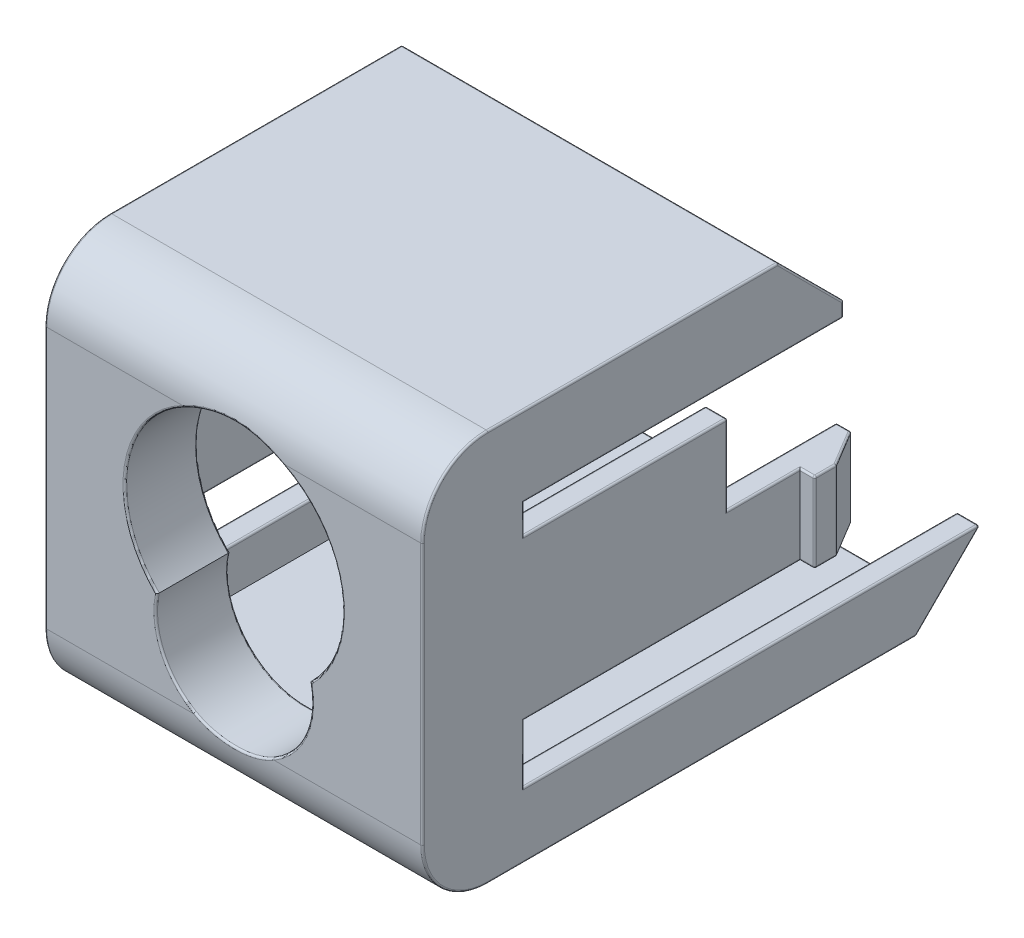
from build123d import *
from build123d.topology import SkipClean

# Parameters (mm, degrees)
EXTRUSION1_DEPTH      = 10.4
EXTRUSION1_DEPTH_BACK = 10.4
EXTRUSION2_DEPTH      = 9.2
EXTRUSION5_DEPTH      = 4
SKETCH4_W             = 1.2
SKETCH4_H             = 4
EXTRUSION6_DEPTH      = 4.4
EXTRUSION8_DEPTH      = 35.506810922
EXTRUSION9_DEPTH      = 2.4
FILLET1_R             = 0.1


with BuildPart() as part:
    # Sketch1 → Extrusion1 (new, two sides: drawn at the far end of the back side and taken through both)
    with BuildSketch(Plane.YZ.offset(-EXTRUSION1_DEPTH_BACK)):
        Polygon((-9.6, -10.8), (-10.8, -10.8), (-10.8, -21.6), (-9.6, -22.8), align=None)
        with BuildLine():
            Line((7.2, 5.6), (-7.2, 5.6))
            ThreePointArc((-7.2, 5.6), (-9.745584412, 4.545584412), (-10.8, 2))
            Line((-10.8, 2), (-10.8, -10.8))
            Line((-10.8, -10.8), (-9.6, -10.8))
            Line((-9.6, -10.8), (-9.6, 4))
            Line((-9.6, 4), (9.36, 4))
            Line((9.36, 4), (9.36, -15.44))
            Line((9.36, -15.44), (10.8, -14))
            Line((10.8, -14), (10.8, 2))
            ThreePointArc((10.8, 2), (9.745584412, 4.545584412), (7.2, 5.6))
        make_face()
        Polygon((6.4, 0), (6.4, -17.6), (7.2, -17.6), (9.36, -15.44), (9.36, 4), (-9.6, 4), (-9.6, -10.8), (-9.6, -22.8), (-7.2, -25.2), (-7.2, 0), (-4, 0), (-4, -15.2), (0.4, -15.2), (0.4, -11.2), (4.8, -11.2), (4.8, 0), align=None)
    extrude(amount=EXTRUSION1_DEPTH + EXTRUSION1_DEPTH_BACK)

    # Sketch2 → Extrusion2 (cut, symmetric)
    with BuildSketch(Plane.YZ):
        Polygon((7.2, -17.6), (9.36, -15.44), (9.36, 4), (-9.6, 4), (-9.6, -10.8), (-9.6, -22.8), (-7.2, -25.2), (-7.2, 0), (-4, 0), (-4, -15.2), (0.4, -15.2), (0.4, -11.2), (4.8, -11.2), (4.8, 0), (6.4, 0), (6.4, -17.6), align=None)
    extrude(amount=EXTRUSION2_DEPTH, both=True, mode=Mode.SUBTRACT)

    # Sketch3 → Extrusion5 (cut, symmetric)
    with BuildSketch(Plane.YZ):
        Polygon((-10.8, -21.6), (-9.6, -22.8), (-9.6, -10.8), (-10.8, -10.8), align=None)
    extrude(amount=EXTRUSION5_DEPTH, both=True, mode=Mode.SUBTRACT)

    # Sketch4 → Extrusion6 (add)
    with BuildSketch(Plane(origin=(0, 0.4, 0), x_dir=(-1, 0, 0), z_dir=(0, 1, 0))):
        Polygon((-9.2, -15.2), (-10.4, -15.2), (-11.2, -15.2), (-11.2, -16.4), (-10, -18.4), (-9.2, -18.4), align=None)
        with Locations((9.8, -13.2)):
            Rectangle(SKETCH4_W, SKETCH4_H)
    extrude(amount=-EXTRUSION6_DEPTH)

    # Sketch5 → Extrusion8 (cut, through all)
    with BuildSketch(Plane.XY.offset(5.6)):
        with BuildLine():
            ThreePointArc((4.201227169, -2.483653846), (0, 7.8), (-4.201227169, -2.483653846))
            ThreePointArc((-4.201227169, -2.483653846), (0, -7.7), (4.201227169, -2.483653846))
        make_face()
    extrude(amount=-EXTRUSION8_DEPTH, mode=Mode.SUBTRACT)

    # Sketch6 → Extrusion9 (add)
    with SkipClean():  # the faces are left unmerged after this step: merging them gives an invalid solid
        with BuildSketch(Plane(origin=(0, 0, 4), x_dir=(-1, 0, 0), z_dir=(0, 0, -1))):
            with BuildLine():
                ThreePointArc((5.157013307, -3.224461538), (0, 9), (-5.157013307, -3.224461538))
                ThreePointArc((-5.157013307, -3.224461538), (0, -8.56), (5.157013307, -3.224461538))
            make_face()
            with BuildLine():
                ThreePointArc((-4.201227169, -2.483653846), (0, -7.7), (4.201227169, -2.483653846))
                ThreePointArc((4.201227169, -2.483653846), (0, 7.8), (-4.201227169, -2.483653846))
            make_face(mode=Mode.SUBTRACT)
        extrude(amount=EXTRUSION9_DEPTH)

    # Fillet1
    fillet1_edges = [part.edges().sort_by_distance(p)[0] for p in [
        (0, 9, 1.6),
        (0, -8.56, 1.6),
        (0, 7.8, 1.6),
        (0, -7.7, 1.6),
        (3.900443691, -5.210121271, 5.6),
        (-3.900443691, -5.210121271, 5.6),
        (-5.921121751, 2.769699549, 5.6),
        (5.921121751, 2.769699549, 5.6),
        (0, 7.8, 5.54964787),
        (0, -7.7, 5.565108694),
        (9.6, -4, -18.4),
        (9.6, 0.4, -18.4),
        (9.2, 0.4, -14.8),
        (10.8, 0.4, -15.2),
        (10.8, -4, -15.2),
        (11.2, -4, -15.8),
        (11.2, 0.4, -15.8),
        (11.2, -1.8, -15.2),
        (9.2, 4.8, -5.6),
        (9.8, 4.8, -11.2),
        (-9.8, 4.8, -11.2),
        (-10.4, 2.6, -11.2),
        (9.2, 5.6, 0),
        (10.4, -4, -7.6),
        (-10.4, 4.8, -5.6),
        (6.6, -9.6, -22.8),
        (10.4, -5.6, 0),
        (-9.2, -4, -7.6),
        (0, 9.36, -15.44),
        (-10.4, 5.6, 0),
        (9.2, 6.8, -17.6),
        (9.2, 8.28, -16.52),
        (9.8, 6.4, -17.6),
        (9.8, -7.2, -25.2),
        (10.4, -7.2, -12.6),
        (-9.2, -5.6, 0),
        (-9.8, 6.4, -17.6),
        (-10.4, 6.4, -8.8),
        (9.8, 7.2, -17.6),
        (7.2, -10.8, -21.6),
        (10.4, -9, -23.4),
        (-9.2, -7.2, -12.6),
        (-9.2, -8.4, -24),
        (-9.8, 7.2, -17.6),
        (-10.4, 6.8, -17.6),
        (-9.8, -7.2, -25.2),
        (0, 10.8, -14),
        (-10.4, 9, -15.8),
        (-7.2, -10.8, -21.6),
        (-10.4, -10.8, -9.8),
        (-10.4, -9.745584412, 4.545584412),
        (-10.4, 0, 5.6),
        (-10.4, 9.745584412, 4.545584412),
        (-10.4, 10.8, -6),
        (-10.4, -9, -23.4),
        (-10.4, -7.2, -12.6),
        (-4, -10.2, -22.2),
        (-4, -10.8, -16.2),
        (10.4, 10.8, -6),
        (10.4, 9.745584412, 4.545584412),
        (10.4, 0, 5.6),
        (10.4, -9.745584412, 4.545584412),
        (10.4, -10.8, -9.8),
        (10.4, 9, -15.8),
        (-10.4, -5.6, 0),
        (0, -10.8, -10.8),
        (-6.6, -9.6, -22.8),
        (-4, -9.6, -16.8),
        (10.4, 6.8, -17.6),
        (-9.2, 8.28, -16.52),
        (-9.2, 6.8, -17.6),
        (4, -10.8, -16.2),
        (0, -9.6, -10.8),
        (4, -10.2, -22.2),
        (10.4, 6.4, -8.8),
        (-9.2, 6.4, -8.8),
        (4, -9.6, -16.8),
        (9.2, -8.4, -24),
        (9.2, -7.2, -12.6),
        (10.4, 5.6, 0),
        (9.2, 6.4, -8.8),
        (-9.2, 5.6, 0),
        (9.2, -5.6, 0),
        (10.4, 4.8, -5.6),
        (-9.2, 4.8, -5.6),
        (9.2, -4, -9.2),
        (10.4, 2.6, -11.2),
        (-9.2, 2.6, -11.2),
        (9.2, -1.8, -18.4),
        (10.4, 0.4, -13.2),
        (9.2, 2.6, -11.2),
        (-9.2, 0.4, -13.2),
        (10.6, -4, -17.4),
        (10.6, 0.4, -17.4),
        (11.2, -1.8, -16.4),
        (10, -1.8, -18.4),
    ]]
    fillet(fillet1_edges, radius=FILLET1_R)


solid = part.part
